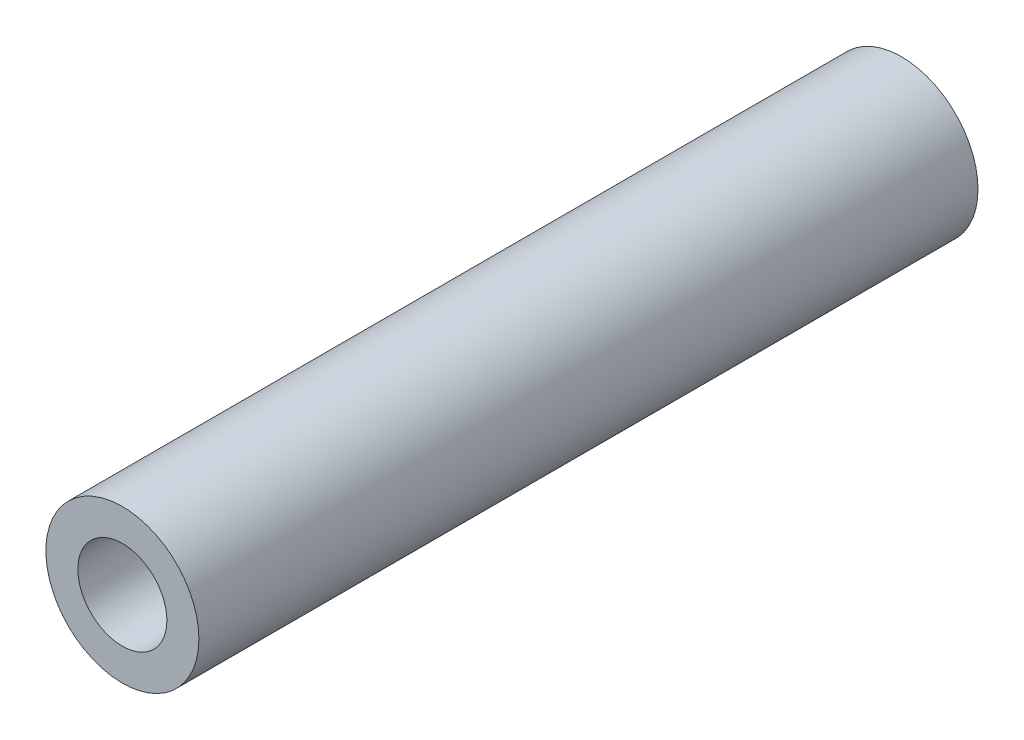
from build123d import *

# Parameters (mm, degrees)
SKETCH_1_R      = 2.75
SKETCH_1_R_2    = 1.6
EXTRUDE_1_DEPTH = 28


with BuildPart() as part:
    # 草图1 → 凸台-拉伸1 (new body)
    with BuildSketch(Plane.XY):
        Circle(SKETCH_1_R)
        Circle(SKETCH_1_R_2, mode=Mode.SUBTRACT)
    extrude(amount=EXTRUDE_1_DEPTH)


solid = part.part
